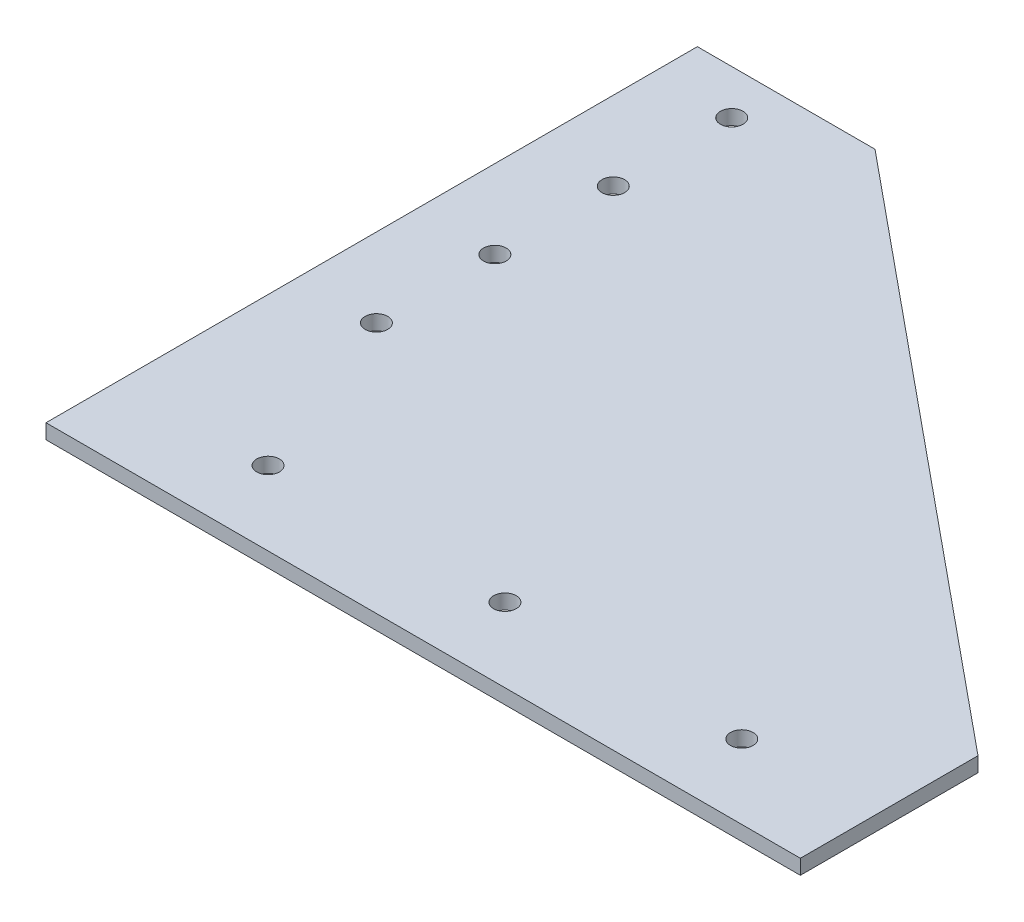
from build123d import *

# Parameters (mm, degrees)
SKETCH1_R           = 2.4257
BOSS_EXTRUDE1_DEPTH = 3.175


with BuildPart() as part:
    # Sketch1 → Boss-Extrude1 (new body)
    with BuildSketch(Plane(origin=(0, 0, 0), x_dir=(1, 0, 0), z_dir=(0, 1, 0))):
        Polygon((0, 0), (0, 139.7), (38.1, 139.7), (161.789864335, 38.1), (161.789864335, 0), align=None)
        with Locations(Location((31.75, 15.875, 0), (0, 0, 270))):
            Circle(SKETCH1_R, mode=Mode.SUBTRACT)
        with Locations(Location((82.55, 15.875, 0), (0, 0, 270))):
            Circle(SKETCH1_R, mode=Mode.SUBTRACT)
        with Locations(Location((133.35, 15.875, 0), (0, 0, 270))):
            Circle(SKETCH1_R, mode=Mode.SUBTRACT)
        with Locations(Location((16.891, 53.975, 0), (0, 0, 270))):
            Circle(SKETCH1_R, mode=Mode.SUBTRACT)
        with Locations(Location((16.891, 79.375, 0), (0, 0, 270))):
            Circle(SKETCH1_R, mode=Mode.SUBTRACT)
        with Locations(Location((16.891, 104.775, 0), (0, 0, 270))):
            Circle(SKETCH1_R, mode=Mode.SUBTRACT)
        with Locations(Location((16.891, 130.175, 0), (0, 0, 270))):
            Circle(SKETCH1_R, mode=Mode.SUBTRACT)
    extrude(amount=BOSS_EXTRUDE1_DEPTH)


solid = part.part
